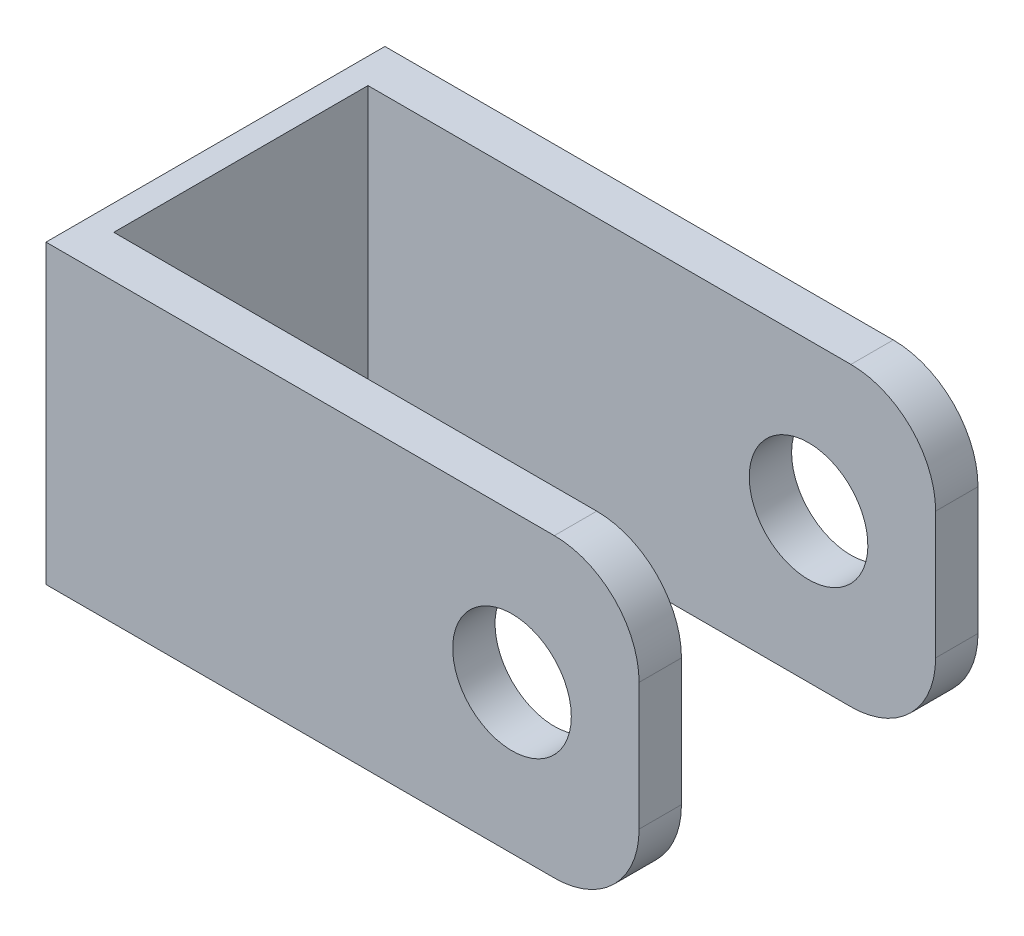
from build123d import *

# Parameters (mm, degrees)
SKETCH1_W           = 40
SKETCH1_H           = 35
BOSS_EXTRUDE1_DEPTH = 3
SKETCH2_W           = 5
SKETCH2_H           = 35
BOSS_EXTRUDE2_DEPTH = 70
FILLET1_R           = 10
SKETCH3_R           = 7
CUT_EXTRUDE1_DEPTH  = 120


with BuildPart() as part:
    # Sketch1 → Boss-Extrude1 (new body)
    with BuildSketch(Plane(origin=(0, 0, 0), x_dir=(0, 0, -1), z_dir=(1, 0, 0))):
        with Locations((-20, 17.5)):
            Rectangle(SKETCH1_W, SKETCH1_H)
    extrude(amount=BOSS_EXTRUDE1_DEPTH)

    # Sketch2 → Boss-Extrude2 (add)
    with BuildSketch(Plane(origin=(0, 0, 0), x_dir=(0, 0, -1), z_dir=(1, 0, 0))):
        with Locations((-37.5, 17.5)):
            Rectangle(SKETCH2_W, SKETCH2_H)
        with Locations((-2.5, 17.5)):
            Rectangle(SKETCH2_W, SKETCH2_H)
    extrude(amount=BOSS_EXTRUDE2_DEPTH)

    # Fillet1
    fillet1_edges = [part.edges().sort_by_distance(p)[0] for p in [
        (70, 35, 37.5),
        (70, 0, 37.5),
        (70, 0, 2.5),
        (70, 35, 2.5),
    ]]
    fillet(fillet1_edges, radius=FILLET1_R)

    # Sketch3 → Cut-Extrude1 (cut)
    with BuildSketch(Plane.XY.offset(40)):
        with Locations(Location((55, 17.5, 0), (0, 0, 90))):
            Circle(SKETCH3_R)
    extrude(amount=-CUT_EXTRUDE1_DEPTH, mode=Mode.SUBTRACT)


solid = part.part
